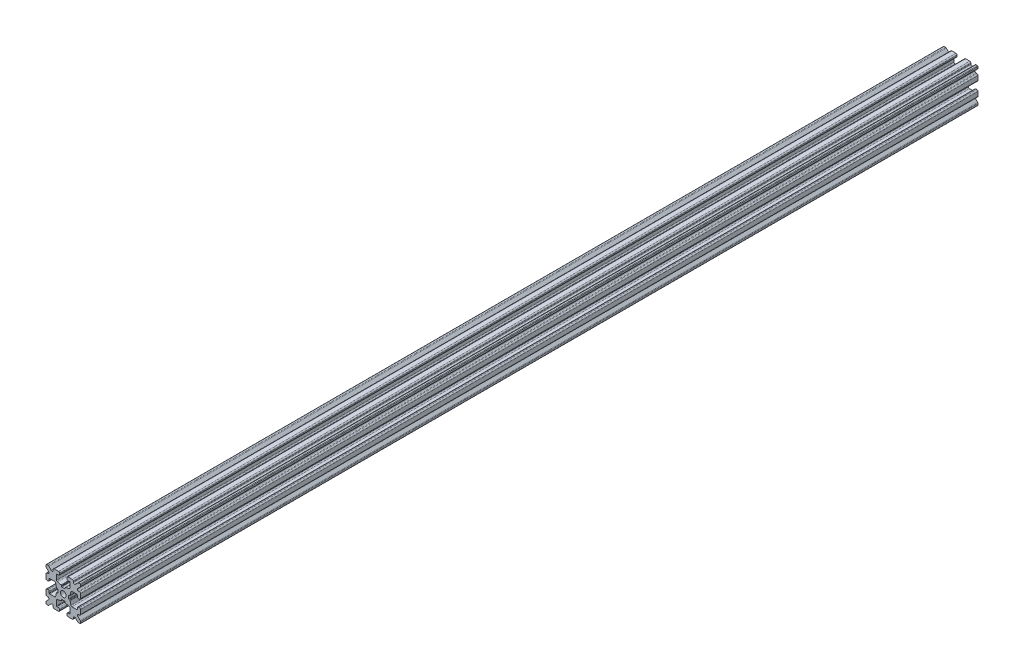
from build123d import *

# Parameters (mm, degrees)
CROQUIS1_R              = 1.25
SALIENTE_EXTRUIR1_DEPTH = 300
CROQUIS2_R              = 1.25
SALIENTE_EXTRUIR2_DEPTH = 90


with BuildPart() as part:
    # Croquis1 → Saliente-Extruir1 (new body)
    with BuildSketch(Plane(origin=(0, 0, -150), x_dir=(-1, 0, 0), z_dir=(0, 0, -1))):
        with BuildLine():
            Line((-2.9, -5.9), (-2.9, -3.80033659))
            ThreePointArc((-2.9, -3.80033659), (-2.790306203, -3.487828881), (-2.509355728, -3.312441801))
            Line((-2.509355728, -3.312441801), (-0.981757709, -2.970049142))
            ThreePointArc((-0.981757709, -2.970049142), (-0.869377519, -2.89989431), (-0.8255, -2.774891226))
            Line((-0.8255, -2.774891226), (-0.8255, -2.5470646))
            ThreePointArc((-0.8255, -2.5470646), (-0.766921356, -2.405643244), (-0.6255, -2.3470646))
            Line((-0.6255, -2.3470646), (0.6255, -2.3470646))
            ThreePointArc((0.6255, -2.3470646), (0.766921356, -2.405643244), (0.8255, -2.5470646))
            Line((0.8255, -2.5470646), (0.8255, -2.774891226))
            ThreePointArc((0.8255, -2.774891226), (0.869377519, -2.89989431), (0.981757709, -2.970049142))
            Line((0.981757709, -2.970049142), (2.509355728, -3.312441801))
            ThreePointArc((2.509355728, -3.312441801), (2.790306203, -3.487828881), (2.9, -3.80033659))
            Line((2.9, -3.80033659), (2.9, -5.9))
            ThreePointArc((2.9, -5.9), (2.841421356, -6.041421356), (2.7, -6.1))
            Line((2.7, -6.1), (2.1, -6.1))
            ThreePointArc((2.1, -6.1), (1.746446609, -6.246446609), (1.6, -6.6))
            Line((1.6, -6.6), (1.6, -7))
            ThreePointArc((1.6, -7), (1.746446609, -7.353553391), (2.1, -7.5))
            Line((2.1, -7.5), (3.9, -7.5))
            ThreePointArc((3.9, -7.5), (4.253553391, -7.353553391), (4.4, -7))
            Line((4.4, -7), (4.4, -6.667766953))
            ThreePointArc((4.4, -6.667766953), (4.708658284, -6.205827187), (5.253553391, -6.314213562))
            Line((5.253553391, -6.314213562), (6.292893219, -7.353553391))
            ThreePointArc((6.292893219, -7.353553391), (6.455104893, -7.461939766), (6.646446609, -7.5))
            Line((6.646446609, -7.5), (7.25, -7.5))
            ThreePointArc((7.25, -7.5), (7.426776695, -7.426776695), (7.5, -7.25))
            Line((7.5, -7.25), (7.5, -6.646446609))
            ThreePointArc((7.5, -6.646446609), (7.461939766, -6.455104893), (7.353553391, -6.292893219))
            Line((7.353553391, -6.292893219), (6.314213562, -5.253553391))
            ThreePointArc((6.314213562, -5.253553391), (6.205827187, -4.708658284), (6.667766953, -4.4))
            Line((6.667766953, -4.4), (7, -4.4))
            ThreePointArc((7, -4.4), (7.353553391, -4.253553391), (7.5, -3.9))
            Line((7.5, -3.9), (7.5, -2.1))
            ThreePointArc((7.5, -2.1), (7.353553391, -1.746446609), (7, -1.6))
            Line((7, -1.6), (6.6, -1.6))
            ThreePointArc((6.6, -1.6), (6.246446609, -1.746446609), (6.1, -2.1))
            Line((6.1, -2.1), (6.1, -2.7))
            ThreePointArc((6.1, -2.7), (6.041421356, -2.841421356), (5.9, -2.9))
            Line((5.9, -2.9), (3.80033659, -2.9))
            ThreePointArc((3.80033659, -2.9), (3.487828881, -2.790306203), (3.312441801, -2.509355728))
            Line((3.312441801, -2.509355728), (2.970049142, -0.981757709))
            ThreePointArc((2.970049142, -0.981757709), (2.89989431, -0.869377519), (2.774891226, -0.8255))
            Line((2.774891226, -0.8255), (2.5470646, -0.8255))
            ThreePointArc((2.5470646, -0.8255), (2.405643244, -0.766921356), (2.3470646, -0.6255))
            Line((2.3470646, -0.6255), (2.3470646, 0.6255))
            ThreePointArc((2.3470646, 0.6255), (2.405643244, 0.766921356), (2.5470646, 0.8255))
            Line((2.5470646, 0.8255), (2.774891226, 0.8255))
            ThreePointArc((2.774891226, 0.8255), (2.89989431, 0.869377519), (2.970049142, 0.981757709))
            Line((2.970049142, 0.981757709), (3.312441801, 2.509355728))
            ThreePointArc((3.312441801, 2.509355728), (3.487828881, 2.790306203), (3.80033659, 2.9))
            Line((3.80033659, 2.9), (5.9, 2.9))
            ThreePointArc((5.9, 2.9), (6.041421356, 2.841421356), (6.1, 2.7))
            Line((6.1, 2.7), (6.1, 2.1))
            ThreePointArc((6.1, 2.1), (6.246446609, 1.746446609), (6.6, 1.6))
            Line((6.6, 1.6), (7, 1.6))
            ThreePointArc((7, 1.6), (7.353553391, 1.746446609), (7.5, 2.1))
            Line((7.5, 2.1), (7.5, 3.9))
            ThreePointArc((7.5, 3.9), (7.353553391, 4.253553391), (7, 4.4))
            Line((7, 4.4), (6.667766953, 4.4))
            ThreePointArc((6.667766953, 4.4), (6.205827187, 4.708658284), (6.314213562, 5.253553391))
            Line((6.314213562, 5.253553391), (7.353553391, 6.292893219))
            ThreePointArc((7.353553391, 6.292893219), (7.461939766, 6.455104893), (7.5, 6.646446609))
            Line((7.5, 6.646446609), (7.5, 7.25))
            ThreePointArc((7.5, 7.25), (7.426776695, 7.426776695), (7.25, 7.5))
            Line((7.25, 7.5), (6.646446609, 7.5))
            ThreePointArc((6.646446609, 7.5), (6.455104893, 7.461939766), (6.292893219, 7.353553391))
            Line((6.292893219, 7.353553391), (5.253553391, 6.314213562))
            ThreePointArc((5.253553391, 6.314213562), (4.708658284, 6.205827187), (4.4, 6.667766953))
            Line((4.4, 6.667766953), (4.4, 7))
            ThreePointArc((4.4, 7), (4.253553391, 7.353553391), (3.9, 7.5))
            Line((3.9, 7.5), (2.1, 7.5))
            ThreePointArc((2.1, 7.5), (1.746446609, 7.353553391), (1.6, 7))
            Line((1.6, 7), (1.6, 6.6))
            ThreePointArc((1.6, 6.6), (1.746446609, 6.246446609), (2.1, 6.1))
            Line((2.1, 6.1), (2.7, 6.1))
            ThreePointArc((2.7, 6.1), (2.841421356, 6.041421356), (2.9, 5.9))
            Line((2.9, 5.9), (2.9, 3.80033659))
            ThreePointArc((2.9, 3.80033659), (2.790306203, 3.487828881), (2.509355728, 3.312441801))
            Line((2.509355728, 3.312441801), (0.981757709, 2.970049142))
            ThreePointArc((0.981757709, 2.970049142), (0.869377519, 2.89989431), (0.8255, 2.774891226))
            Line((0.8255, 2.774891226), (0.8255, 2.5470646))
            ThreePointArc((0.8255, 2.5470646), (0.766921356, 2.405643244), (0.6255, 2.3470646))
            Line((0.6255, 2.3470646), (-0.6255, 2.3470646))
            ThreePointArc((-0.6255, 2.3470646), (-0.766921356, 2.405643244), (-0.8255, 2.5470646))
            Line((-0.8255, 2.5470646), (-0.8255, 2.774891226))
            ThreePointArc((-0.8255, 2.774891226), (-0.869377519, 2.89989431), (-0.981757709, 2.970049142))
            Line((-0.981757709, 2.970049142), (-2.509355728, 3.312441801))
            ThreePointArc((-2.509355728, 3.312441801), (-2.790306203, 3.487828881), (-2.9, 3.80033659))
            Line((-2.9, 3.80033659), (-2.9, 5.9))
            ThreePointArc((-2.9, 5.9), (-2.841421356, 6.041421356), (-2.7, 6.1))
            Line((-2.7, 6.1), (-2.1, 6.1))
            ThreePointArc((-2.1, 6.1), (-1.746446609, 6.246446609), (-1.6, 6.6))
            Line((-1.6, 6.6), (-1.6, 7))
            ThreePointArc((-1.6, 7), (-1.746446609, 7.353553391), (-2.1, 7.5))
            Line((-2.1, 7.5), (-3.9, 7.5))
            ThreePointArc((-3.9, 7.5), (-4.253553391, 7.353553391), (-4.4, 7))
            Line((-4.4, 7), (-4.4, 6.667766953))
            ThreePointArc((-4.4, 6.667766953), (-4.708658284, 6.205827187), (-5.253553391, 6.314213562))
            Line((-5.253553391, 6.314213562), (-6.292893219, 7.353553391))
            ThreePointArc((-6.292893219, 7.353553391), (-6.455104893, 7.461939766), (-6.646446609, 7.5))
            Line((-6.646446609, 7.5), (-7.25, 7.5))
            ThreePointArc((-7.25, 7.5), (-7.426776695, 7.426776695), (-7.5, 7.25))
            Line((-7.5, 7.25), (-7.5, 6.646446609))
            ThreePointArc((-7.5, 6.646446609), (-7.461939766, 6.455104893), (-7.353553391, 6.292893219))
            Line((-7.353553391, 6.292893219), (-6.314213562, 5.253553391))
            ThreePointArc((-6.314213562, 5.253553391), (-6.205827187, 4.708658284), (-6.667766953, 4.4))
            Line((-6.667766953, 4.4), (-7, 4.4))
            ThreePointArc((-7, 4.4), (-7.353553391, 4.253553391), (-7.5, 3.9))
            Line((-7.5, 3.9), (-7.5, 2.1))
            ThreePointArc((-7.5, 2.1), (-7.353553391, 1.746446609), (-7, 1.6))
            Line((-7, 1.6), (-6.6, 1.6))
            ThreePointArc((-6.6, 1.6), (-6.246446609, 1.746446609), (-6.1, 2.1))
            Line((-6.1, 2.1), (-6.1, 2.7))
            ThreePointArc((-6.1, 2.7), (-6.041421356, 2.841421356), (-5.9, 2.9))
            Line((-5.9, 2.9), (-3.80033659, 2.9))
            ThreePointArc((-3.80033659, 2.9), (-3.487828881, 2.790306203), (-3.312441801, 2.509355728))
            Line((-3.312441801, 2.509355728), (-2.970049142, 0.981757709))
            ThreePointArc((-2.970049142, 0.981757709), (-2.89989431, 0.869377519), (-2.774891226, 0.8255))
            Line((-2.774891226, 0.8255), (-2.5470646, 0.8255))
            ThreePointArc((-2.5470646, 0.8255), (-2.405643244, 0.766921356), (-2.3470646, 0.6255))
            Line((-2.3470646, 0.6255), (-2.3470646, -0.6255))
            ThreePointArc((-2.3470646, -0.6255), (-2.405643244, -0.766921356), (-2.5470646, -0.8255))
            Line((-2.5470646, -0.8255), (-2.774891226, -0.8255))
            ThreePointArc((-2.774891226, -0.8255), (-2.89989431, -0.869377519), (-2.970049142, -0.981757709))
            Line((-2.970049142, -0.981757709), (-3.312441801, -2.509355728))
            ThreePointArc((-3.312441801, -2.509355728), (-3.487828881, -2.790306203), (-3.80033659, -2.9))
            Line((-3.80033659, -2.9), (-5.9, -2.9))
            ThreePointArc((-5.9, -2.9), (-6.041421356, -2.841421356), (-6.1, -2.7))
            Line((-6.1, -2.7), (-6.1, -2.1))
            ThreePointArc((-6.1, -2.1), (-6.246446609, -1.746446609), (-6.6, -1.6))
            Line((-6.6, -1.6), (-7, -1.6))
            ThreePointArc((-7, -1.6), (-7.353553391, -1.746446609), (-7.5, -2.1))
            Line((-7.5, -2.1), (-7.5, -3.9))
            ThreePointArc((-7.5, -3.9), (-7.353553391, -4.253553391), (-7, -4.4))
            Line((-7, -4.4), (-6.667766953, -4.4))
            ThreePointArc((-6.667766953, -4.4), (-6.205827187, -4.708658284), (-6.314213562, -5.253553391))
            Line((-6.314213562, -5.253553391), (-7.353553391, -6.292893219))
            ThreePointArc((-7.353553391, -6.292893219), (-7.461939766, -6.455104893), (-7.5, -6.646446609))
            Line((-7.5, -6.646446609), (-7.5, -7.25))
            ThreePointArc((-7.5, -7.25), (-7.426776695, -7.426776695), (-7.25, -7.5))
            Line((-7.25, -7.5), (-6.646446609, -7.5))
            ThreePointArc((-6.646446609, -7.5), (-6.455104893, -7.461939766), (-6.292893219, -7.353553391))
            Line((-6.292893219, -7.353553391), (-5.253553391, -6.314213562))
            ThreePointArc((-5.253553391, -6.314213562), (-4.708658284, -6.205827187), (-4.4, -6.667766953))
            Line((-4.4, -6.667766953), (-4.4, -7))
            ThreePointArc((-4.4, -7), (-4.253553391, -7.353553391), (-3.9, -7.5))
            Line((-3.9, -7.5), (-2.1, -7.5))
            ThreePointArc((-2.1, -7.5), (-1.746446609, -7.353553391), (-1.6, -7))
            Line((-1.6, -7), (-1.6, -6.6))
            ThreePointArc((-1.6, -6.6), (-1.746446609, -6.246446609), (-2.1, -6.1))
            Line((-2.1, -6.1), (-2.7, -6.1))
            ThreePointArc((-2.7, -6.1), (-2.841421356, -6.041421356), (-2.9, -5.9))
        make_face()
        with Locations(Location((0, 0, 0), (0, 0, 180))):
            Circle(CROQUIS1_R, mode=Mode.SUBTRACT)
    extrude(amount=-SALIENTE_EXTRUIR1_DEPTH)

    # Croquis2 → Saliente-Extruir2 (add)
    with BuildSketch(Plane.XY.offset(150)):
        with BuildLine():
            Line((2.7, -6.1), (2.1, -6.1))
            ThreePointArc((2.1, -6.1), (1.746446609, -6.246446609), (1.6, -6.6))
            Line((1.6, -6.6), (1.6, -7))
            ThreePointArc((1.6, -7), (1.746446609, -7.353553391), (2.1, -7.5))
            Line((2.1, -7.5), (3.9, -7.5))
            ThreePointArc((3.9, -7.5), (4.253553391, -7.353553391), (4.4, -7))
            Line((4.4, -7), (4.4, -6.667766953))
            ThreePointArc((4.4, -6.667766953), (4.708658284, -6.205827187), (5.253553391, -6.314213562))
            Line((5.253553391, -6.314213562), (6.292893219, -7.353553391))
            ThreePointArc((6.292893219, -7.353553391), (6.455104893, -7.461939766), (6.646446609, -7.5))
            Line((6.646446609, -7.5), (7.25, -7.5))
            ThreePointArc((7.25, -7.5), (7.426776695, -7.426776695), (7.5, -7.25))
            Line((7.5, -7.25), (7.5, -6.646446609))
            ThreePointArc((7.5, -6.646446609), (7.461939766, -6.455104893), (7.353553391, -6.292893219))
            Line((7.353553391, -6.292893219), (6.314213562, -5.253553391))
            ThreePointArc((6.314213562, -5.253553391), (6.205827187, -4.708658284), (6.667766953, -4.4))
            Line((6.667766953, -4.4), (7, -4.4))
            ThreePointArc((7, -4.4), (7.353553391, -4.253553391), (7.5, -3.9))
            Line((7.5, -3.9), (7.5, -2.1))
            ThreePointArc((7.5, -2.1), (7.353553391, -1.746446609), (7, -1.6))
            Line((7, -1.6), (6.6, -1.6))
            ThreePointArc((6.6, -1.6), (6.246446609, -1.746446609), (6.1, -2.1))
            Line((6.1, -2.1), (6.1, -2.7))
            ThreePointArc((6.1, -2.7), (6.041421356, -2.841421356), (5.9, -2.9))
            Line((5.9, -2.9), (3.80033659, -2.9))
            ThreePointArc((3.80033659, -2.9), (3.487828881, -2.790306203), (3.312441801, -2.509355728))
            Line((3.312441801, -2.509355728), (2.970049142, -0.981757709))
            ThreePointArc((2.970049142, -0.981757709), (2.89989431, -0.869377519), (2.774891226, -0.8255))
            Line((2.774891226, -0.8255), (2.5470646, -0.8255))
            ThreePointArc((2.5470646, -0.8255), (2.405643244, -0.766921356), (2.3470646, -0.6255))
            Line((2.3470646, -0.6255), (2.3470646, 0.6255))
            ThreePointArc((2.3470646, 0.6255), (2.405643244, 0.766921356), (2.5470646, 0.8255))
            Line((2.5470646, 0.8255), (2.774891226, 0.8255))
            ThreePointArc((2.774891226, 0.8255), (2.89989431, 0.869377519), (2.970049142, 0.981757709))
            Line((2.970049142, 0.981757709), (3.312441801, 2.509355728))
            ThreePointArc((3.312441801, 2.509355728), (3.487828881, 2.790306203), (3.80033659, 2.9))
            Line((3.80033659, 2.9), (5.9, 2.9))
            ThreePointArc((5.9, 2.9), (6.041421356, 2.841421356), (6.1, 2.7))
            Line((6.1, 2.7), (6.1, 2.1))
            ThreePointArc((6.1, 2.1), (6.246446609, 1.746446609), (6.6, 1.6))
            Line((6.6, 1.6), (7, 1.6))
            ThreePointArc((7, 1.6), (7.353553391, 1.746446609), (7.5, 2.1))
            Line((7.5, 2.1), (7.5, 3.9))
            ThreePointArc((7.5, 3.9), (7.353553391, 4.253553391), (7, 4.4))
            Line((7, 4.4), (6.667766953, 4.4))
            ThreePointArc((6.667766953, 4.4), (6.205827187, 4.708658284), (6.314213562, 5.253553391))
            Line((6.314213562, 5.253553391), (7.353553391, 6.292893219))
            ThreePointArc((7.353553391, 6.292893219), (7.461939766, 6.455104893), (7.5, 6.646446609))
            Line((7.5, 6.646446609), (7.5, 7.25))
            ThreePointArc((7.5, 7.25), (7.426776695, 7.426776695), (7.25, 7.5))
            Line((7.25, 7.5), (6.646446609, 7.5))
            ThreePointArc((6.646446609, 7.5), (6.455104893, 7.461939766), (6.292893219, 7.353553391))
            Line((6.292893219, 7.353553391), (5.253553391, 6.314213562))
            ThreePointArc((5.253553391, 6.314213562), (4.708658284, 6.205827187), (4.4, 6.667766953))
            Line((4.4, 6.667766953), (4.4, 7))
            ThreePointArc((4.4, 7), (4.253553391, 7.353553391), (3.9, 7.5))
            Line((3.9, 7.5), (2.1, 7.5))
            ThreePointArc((2.1, 7.5), (1.746446609, 7.353553391), (1.6, 7))
            Line((1.6, 7), (1.6, 6.6))
            ThreePointArc((1.6, 6.6), (1.746446609, 6.246446609), (2.1, 6.1))
            Line((2.1, 6.1), (2.7, 6.1))
            ThreePointArc((2.7, 6.1), (2.841421356, 6.041421356), (2.9, 5.9))
            Line((2.9, 5.9), (2.9, 3.80033659))
            ThreePointArc((2.9, 3.80033659), (2.790306203, 3.487828881), (2.509355728, 3.312441801))
            Line((2.509355728, 3.312441801), (0.981757709, 2.970049142))
            ThreePointArc((0.981757709, 2.970049142), (0.869377519, 2.89989431), (0.8255, 2.774891226))
            Line((0.8255, 2.774891226), (0.8255, 2.5470646))
            ThreePointArc((0.8255, 2.5470646), (0.766921356, 2.405643244), (0.6255, 2.3470646))
            Line((0.6255, 2.3470646), (-0.6255, 2.3470646))
            ThreePointArc((-0.6255, 2.3470646), (-0.766921356, 2.405643244), (-0.8255, 2.5470646))
            Line((-0.8255, 2.5470646), (-0.8255, 2.774891226))
            ThreePointArc((-0.8255, 2.774891226), (-0.869377519, 2.89989431), (-0.981757709, 2.970049142))
            Line((-0.981757709, 2.970049142), (-2.509355728, 3.312441801))
            ThreePointArc((-2.509355728, 3.312441801), (-2.790306203, 3.487828881), (-2.9, 3.80033659))
            Line((-2.9, 3.80033659), (-2.9, 5.9))
            ThreePointArc((-2.9, 5.9), (-2.841421356, 6.041421356), (-2.7, 6.1))
            Line((-2.7, 6.1), (-2.1, 6.1))
            ThreePointArc((-2.1, 6.1), (-1.746446609, 6.246446609), (-1.6, 6.6))
            Line((-1.6, 6.6), (-1.6, 7))
            ThreePointArc((-1.6, 7), (-1.746446609, 7.353553391), (-2.1, 7.5))
            Line((-2.1, 7.5), (-3.9, 7.5))
            ThreePointArc((-3.9, 7.5), (-4.253553391, 7.353553391), (-4.4, 7))
            Line((-4.4, 7), (-4.4, 6.667766953))
            ThreePointArc((-4.4, 6.667766953), (-4.708658284, 6.205827187), (-5.253553391, 6.314213562))
            Line((-5.253553391, 6.314213562), (-6.292893219, 7.353553391))
            ThreePointArc((-6.292893219, 7.353553391), (-6.455104893, 7.461939766), (-6.646446609, 7.5))
            Line((-6.646446609, 7.5), (-7.25, 7.5))
            ThreePointArc((-7.25, 7.5), (-7.426776695, 7.426776695), (-7.5, 7.25))
            Line((-7.5, 7.25), (-7.5, 6.646446609))
            ThreePointArc((-7.5, 6.646446609), (-7.461939766, 6.455104893), (-7.353553391, 6.292893219))
            Line((-7.353553391, 6.292893219), (-6.314213562, 5.253553391))
            ThreePointArc((-6.314213562, 5.253553391), (-6.205827187, 4.708658284), (-6.667766953, 4.4))
            Line((-6.667766953, 4.4), (-7, 4.4))
            ThreePointArc((-7, 4.4), (-7.353553391, 4.253553391), (-7.5, 3.9))
            Line((-7.5, 3.9), (-7.5, 2.1))
            ThreePointArc((-7.5, 2.1), (-7.353553391, 1.746446609), (-7, 1.6))
            Line((-7, 1.6), (-6.6, 1.6))
            ThreePointArc((-6.6, 1.6), (-6.246446609, 1.746446609), (-6.1, 2.1))
            Line((-6.1, 2.1), (-6.1, 2.7))
            ThreePointArc((-6.1, 2.7), (-6.041421356, 2.841421356), (-5.9, 2.9))
            Line((-5.9, 2.9), (-3.80033659, 2.9))
            ThreePointArc((-3.80033659, 2.9), (-3.487828881, 2.790306203), (-3.312441801, 2.509355728))
            Line((-3.312441801, 2.509355728), (-2.970049142, 0.981757709))
            ThreePointArc((-2.970049142, 0.981757709), (-2.89989431, 0.869377519), (-2.774891226, 0.8255))
            Line((-2.774891226, 0.8255), (-2.5470646, 0.8255))
            ThreePointArc((-2.5470646, 0.8255), (-2.405643244, 0.766921356), (-2.3470646, 0.6255))
            Line((-2.3470646, 0.6255), (-2.3470646, -0.6255))
            ThreePointArc((-2.3470646, -0.6255), (-2.405643244, -0.766921356), (-2.5470646, -0.8255))
            Line((-2.5470646, -0.8255), (-2.774891226, -0.8255))
            ThreePointArc((-2.774891226, -0.8255), (-2.89989431, -0.869377519), (-2.970049142, -0.981757709))
            Line((-2.970049142, -0.981757709), (-3.312441801, -2.509355728))
            ThreePointArc((-3.312441801, -2.509355728), (-3.487828881, -2.790306203), (-3.80033659, -2.9))
            Line((-3.80033659, -2.9), (-5.9, -2.9))
            ThreePointArc((-5.9, -2.9), (-6.041421356, -2.841421356), (-6.1, -2.7))
            Line((-6.1, -2.7), (-6.1, -2.1))
            ThreePointArc((-6.1, -2.1), (-6.246446609, -1.746446609), (-6.6, -1.6))
            Line((-6.6, -1.6), (-7, -1.6))
            ThreePointArc((-7, -1.6), (-7.353553391, -1.746446609), (-7.5, -2.1))
            Line((-7.5, -2.1), (-7.5, -3.9))
            ThreePointArc((-7.5, -3.9), (-7.353553391, -4.253553391), (-7, -4.4))
            Line((-7, -4.4), (-6.667766953, -4.4))
            ThreePointArc((-6.667766953, -4.4), (-6.205827187, -4.708658284), (-6.314213562, -5.253553391))
            Line((-6.314213562, -5.253553391), (-7.353553391, -6.292893219))
            ThreePointArc((-7.353553391, -6.292893219), (-7.461939766, -6.455104893), (-7.5, -6.646446609))
            Line((-7.5, -6.646446609), (-7.5, -7.25))
            ThreePointArc((-7.5, -7.25), (-7.426776695, -7.426776695), (-7.25, -7.5))
            Line((-7.25, -7.5), (-6.646446609, -7.5))
            ThreePointArc((-6.646446609, -7.5), (-6.455104893, -7.461939766), (-6.292893219, -7.353553391))
            Line((-6.292893219, -7.353553391), (-5.253553391, -6.314213562))
            ThreePointArc((-5.253553391, -6.314213562), (-4.708658284, -6.205827187), (-4.4, -6.667766953))
            Line((-4.4, -6.667766953), (-4.4, -7))
            ThreePointArc((-4.4, -7), (-4.253553391, -7.353553391), (-3.9, -7.5))
            Line((-3.9, -7.5), (-2.1, -7.5))
            ThreePointArc((-2.1, -7.5), (-1.746446609, -7.353553391), (-1.6, -7))
            Line((-1.6, -7), (-1.6, -6.6))
            ThreePointArc((-1.6, -6.6), (-1.746446609, -6.246446609), (-2.1, -6.1))
            Line((-2.1, -6.1), (-2.7, -6.1))
            ThreePointArc((-2.7, -6.1), (-2.841421356, -6.041421356), (-2.9, -5.9))
            Line((-2.9, -5.9), (-2.9, -3.80033659))
            ThreePointArc((-2.9, -3.80033659), (-2.790306203, -3.487828881), (-2.509355728, -3.312441801))
            Line((-2.509355728, -3.312441801), (-0.981757709, -2.970049142))
            ThreePointArc((-0.981757709, -2.970049142), (-0.869377519, -2.89989431), (-0.8255, -2.774891226))
            Line((-0.8255, -2.774891226), (-0.8255, -2.5470646))
            ThreePointArc((-0.8255, -2.5470646), (-0.766921356, -2.405643244), (-0.6255, -2.3470646))
            Line((-0.6255, -2.3470646), (0.6255, -2.3470646))
            ThreePointArc((0.6255, -2.3470646), (0.766921356, -2.405643244), (0.8255, -2.5470646))
            Line((0.8255, -2.5470646), (0.8255, -2.774891226))
            ThreePointArc((0.8255, -2.774891226), (0.869377519, -2.89989431), (0.981757709, -2.970049142))
            Line((0.981757709, -2.970049142), (2.509355728, -3.312441801))
            ThreePointArc((2.509355728, -3.312441801), (2.790306203, -3.487828881), (2.9, -3.80033659))
            Line((2.9, -3.80033659), (2.9, -5.9))
            ThreePointArc((2.9, -5.9), (2.841421356, -6.041421356), (2.7, -6.1))
        make_face()
        Circle(CROQUIS2_R, mode=Mode.SUBTRACT)
    extrude(amount=SALIENTE_EXTRUIR2_DEPTH)


solid = part.part
